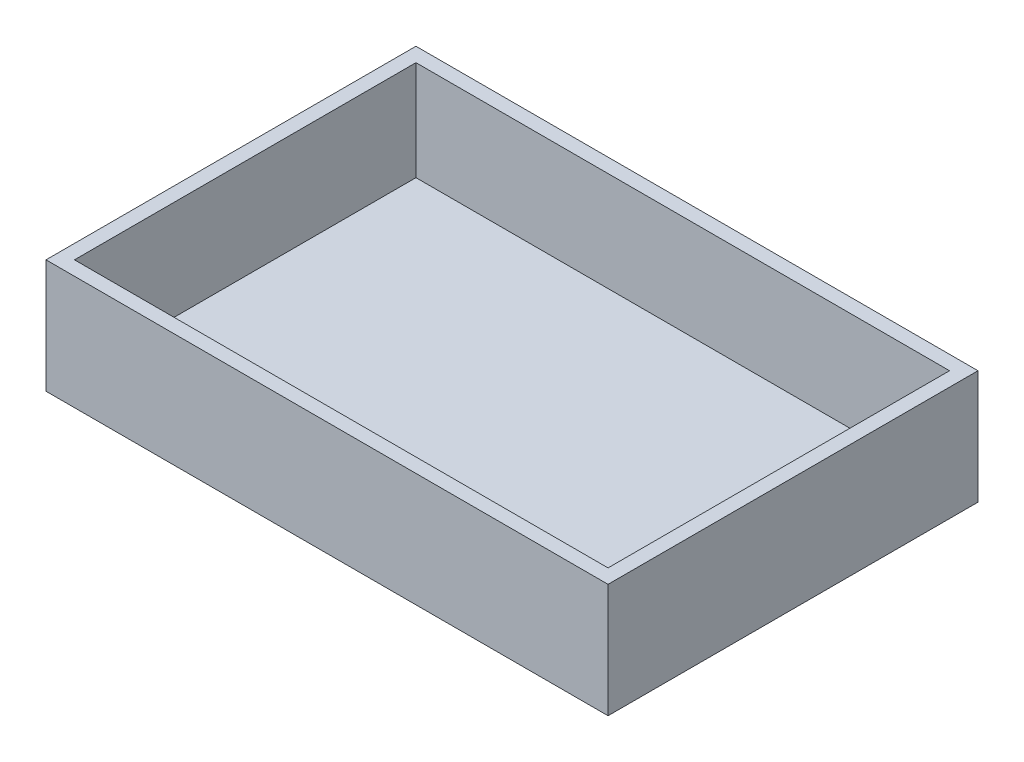
from build123d import *

# Parameters (mm, degrees)
SKETCH1_W           = 395
SKETCH1_H           = 260
SKETCH1_W_2         = 375
SKETCH1_H_2         = 240
BOSS_EXTRUDE1_DEPTH = 70
SKETCH2_W           = 395
SKETCH2_H           = 260
BOSS_EXTRUDE2_DEPTH = 10


with BuildPart() as part:
    # Sketch1 → Boss-Extrude1 (new body)
    with BuildSketch(Plane(origin=(0, 0, 0), x_dir=(1, 0, 0), z_dir=(0, 1, 0))):
        Rectangle(SKETCH1_W, SKETCH1_H)
        Rectangle(SKETCH1_W_2, SKETCH1_H_2, mode=Mode.SUBTRACT)
    extrude(amount=BOSS_EXTRUDE1_DEPTH)

    # Sketch2 → Boss-Extrude2 (add)
    with BuildSketch(Plane.XZ):
        Rectangle(SKETCH2_W, SKETCH2_H)
    extrude(amount=BOSS_EXTRUDE2_DEPTH)


solid = part.part
